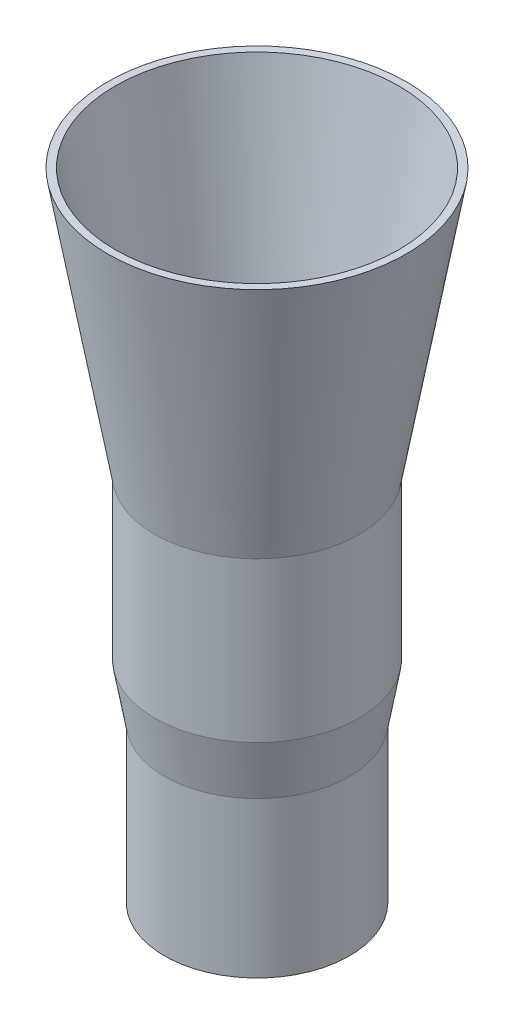
from build123d import *


with BuildPart() as part:
    # 草图1 → 旋转1 (revolve)
    with BuildSketch(Plane.XY, mode=Mode.PRIVATE) as revolve_1_sk:
        Polygon((0, 0), (250, 0), (250, 420), (276.449047106, 570), (276.449047106, 1000), (403.404473216, 1720), (383.404473216, 1720), (256.449047106, 1000), (256.449047106, 570), (230, 420), (230, 20), (0, 20), align=None)
    revolve(revolve_1_sk.sketch.rotate(Axis((0, 0, 0), (0, 1, 0)), 90), axis=Axis((0, 0, 0), (0, 1, 0)))


solid = part.part
